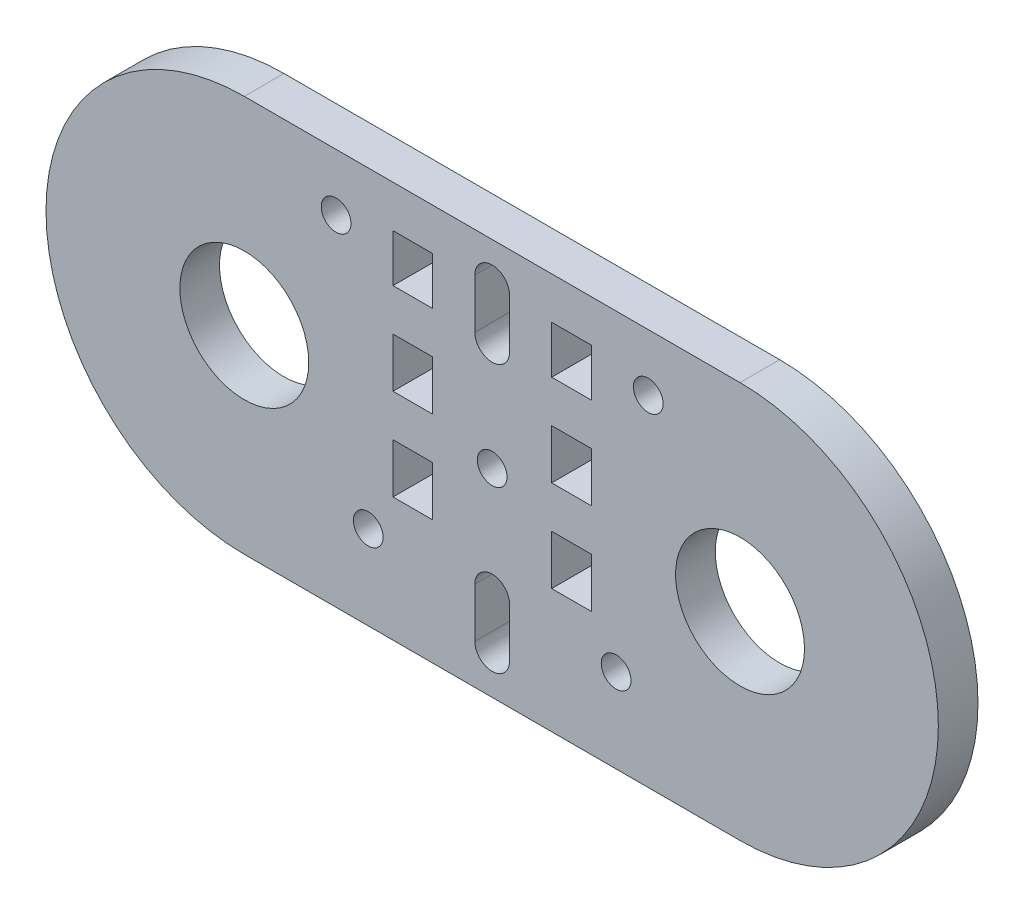
from build123d import *

# Parameters (mm, degrees)
SKETCH_1_R      = 1.5
SKETCH_1_R_2    = 6.5
SKETCH_1_W      = 4
SKETCH_1_H      = 4.8
SKETCH_1_H_2    = 5
EXTRUDE_1_DEPTH = 4


with BuildPart() as part:
    # 草图1 → 凸台-拉伸1 (new body)
    with BuildSketch(Plane.XY):
        with BuildLine():
            Line((-11.37741807, 44.104762576), (9.62258193, 44.104762576))
            Line((9.62258193, 44.104762576), (17.62258193, 44.104762576))
            Line((17.62258193, 44.104762576), (38.62258193, 44.104762576))
            ThreePointArc((38.62258193, 44.104762576), (58.62258193, 24.104762576), (38.62258193, 4.104762576))
            Line((38.62258193, 4.104762576), (-11.37741807, 4.104762576))
            ThreePointArc((-11.37741807, 4.104762576), (-31.37741807, 24.104762576), (-11.37741807, 44.104762576))
        make_face()
        with Locations((1.12258193, 12.583043954)):
            Circle(SKETCH_1_R, mode=Mode.SUBTRACT)
        with Locations(Location((26.12258193, 12.583043954, 0), (0, 0, 180))):
            Circle(SKETCH_1_R, mode=Mode.SUBTRACT)
        with Locations((13.62258193, 24.104762576)):
            Circle(SKETCH_1_R, mode=Mode.SUBTRACT)
        with Locations((-11.37741807, 24.104762576)):
            Circle(SKETCH_1_R_2, mode=Mode.SUBTRACT)
        with Locations((38.62258193, 24.104762576)):
            Circle(SKETCH_1_R_2, mode=Mode.SUBTRACT)
        with Locations((29.363598717, 38.36208455)):
            Circle(SKETCH_1_R, mode=Mode.SUBTRACT)
        with Locations((-2.118434858, 38.36208455)):
            Circle(SKETCH_1_R, mode=Mode.SUBTRACT)
        with Locations((21.62258193, 37.474762576)):
            Rectangle(SKETCH_1_W, SKETCH_1_H, mode=Mode.SUBTRACT)
        with Locations((21.62258193, 28.344762576)):
            Rectangle(SKETCH_1_W, SKETCH_1_H_2, mode=Mode.SUBTRACT)
        with Locations((5.62258193, 37.474762576)):
            Rectangle(SKETCH_1_W, SKETCH_1_H, mode=Mode.SUBTRACT)
        with Locations((5.62258193, 28.344762576)):
            Rectangle(SKETCH_1_W, SKETCH_1_H_2, mode=Mode.SUBTRACT)
        with Locations((5.62258193, 19.114762576)):
            Rectangle(SKETCH_1_W, SKETCH_1_H_2, mode=Mode.SUBTRACT)
        with Locations((21.62258193, 19.114762576)):
            Rectangle(SKETCH_1_W, SKETCH_1_H_2, mode=Mode.SUBTRACT)
        with BuildLine():
            Line((11.87258193, 8.127075217), (11.87258193, 13.127075217))
            ThreePointArc((11.87258193, 13.127075217), (13.62258193, 14.877075217), (15.37258193, 13.127075217))
            Line((15.37258193, 13.127075217), (15.37258193, 8.127075217))
            ThreePointArc((15.37258193, 8.127075217), (13.62258193, 6.377075217), (11.87258193, 8.127075217))
        make_face(mode=Mode.SUBTRACT)
        with BuildLine():
            Line((15.37258193, 40.127075217), (15.37258193, 35.127075217))
            ThreePointArc((15.37258193, 35.127075217), (13.62258193, 33.377075217), (11.87258193, 35.127075217))
            Line((11.87258193, 35.127075217), (11.87258193, 40.127075217))
            ThreePointArc((11.87258193, 40.127075217), (13.62258193, 41.877075217), (15.37258193, 40.127075217))
        make_face(mode=Mode.SUBTRACT)
    extrude(amount=EXTRUDE_1_DEPTH)


solid = part.part
